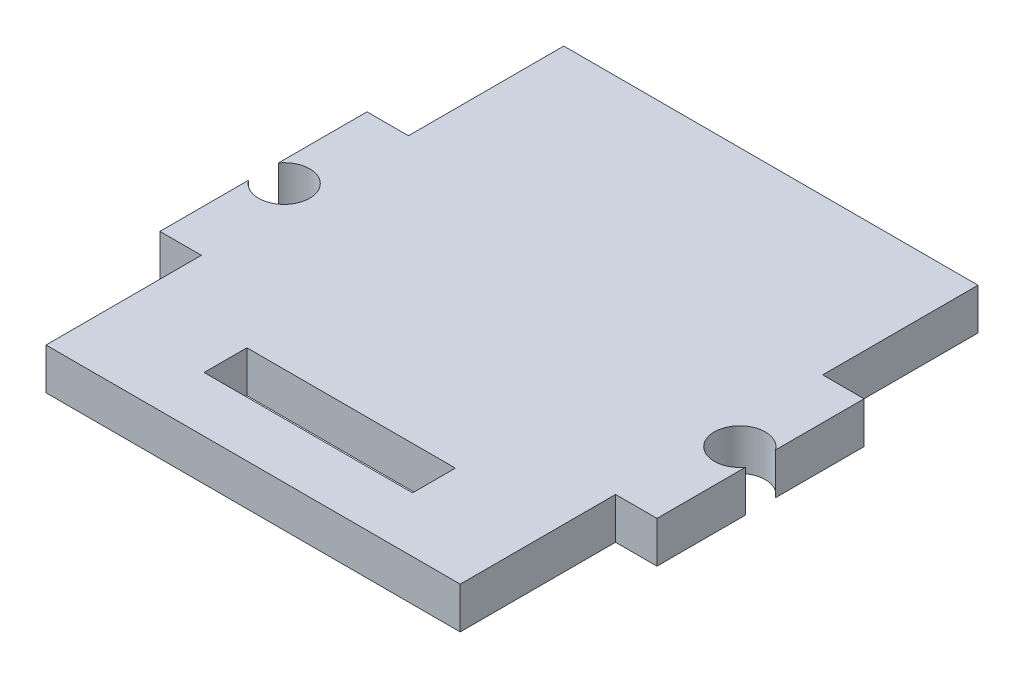
from build123d import *

# Parameters (mm, degrees)
SKETCH1_W           = 30
SKETCH1_H           = 37.5
BOSS_EXTRUDE1_DEPTH = 3
SKETCH2_W           = 3
SKETCH2_H           = 15
BOSS_EXTRUDE2_DEPTH = 3
SKETCH3_R           = 1.85
CUT_EXTRUDE1_DEPTH  = 27.164145314
SKETCH4_W           = 15.1
SKETCH4_H           = 3.1
CUT_EXTRUDE2_DEPTH  = 27.164145314


with BuildPart() as part:
    # Sketch1 → Boss-Extrude1 (new body)
    with BuildSketch(Plane(origin=(0, 0, 0), x_dir=(1, 0, 0), z_dir=(0, 1, 0))):
        Rectangle(SKETCH1_W, SKETCH1_H)
    extrude(amount=BOSS_EXTRUDE1_DEPTH)

    # Sketch2 → Boss-Extrude2 (add)
    with BuildSketch(Plane(origin=(0, 3, 0), x_dir=(1, 0, 0), z_dir=(0, 1, 0))):
        with Locations((-16.5, 0)):
            Rectangle(SKETCH2_W, SKETCH2_H)
        with Locations((16.5, 0)):
            Rectangle(SKETCH2_W, SKETCH2_H)
    extrude(amount=-BOSS_EXTRUDE2_DEPTH)

    # Sketch3 → Cut-Extrude1 (cut, through all)
    with BuildSketch(Plane(origin=(0, 3, 0), x_dir=(1, 0, 0), z_dir=(0, 1, 0))):
        with Locations((-16.5, 0)):
            Circle(SKETCH3_R)
        with Locations((16.5, 0)):
            Circle(SKETCH3_R)
    extrude(amount=-CUT_EXTRUDE1_DEPTH, mode=Mode.SUBTRACT)

    # Sketch4 → Cut-Extrude2 (cut, through all)
    with BuildSketch(Plane(origin=(0, 3, 0), x_dir=(1, 0, 0), z_dir=(0, 1, 0))):
        with Locations((0, -13.2)):
            Rectangle(SKETCH4_W, SKETCH4_H)
    extrude(amount=-CUT_EXTRUDE2_DEPTH, mode=Mode.SUBTRACT)


solid = part.part
